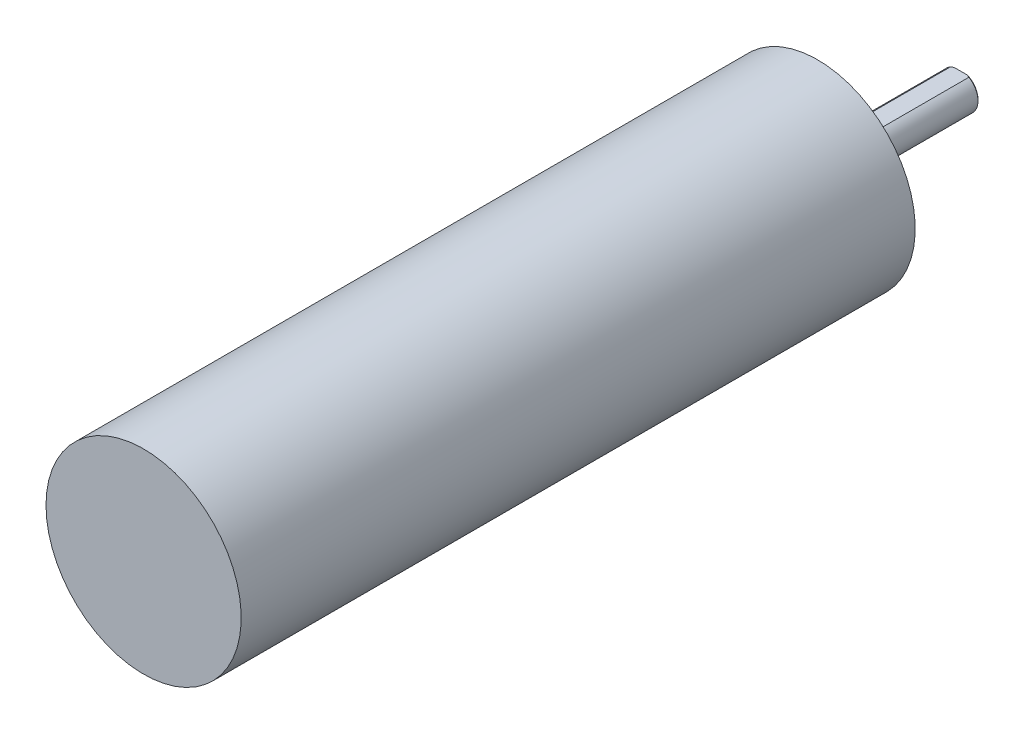
from build123d import *
from build123d.topology import SkipClean

# Parameters (mm, degrees)
SKETCH_1_R             = 8
EXTRUDE_1_DEPTH        = 55.2
EXTRUDE_2_DEPTH        = 11.8
SKETCH_3_R             = 3
EXTRUDE_3_DEPTH        = 1
SKETCH_4_R             = 2.75
EXTRUDE_4_DEPTH        = 1.6
EXTRUDE_5_DEPTH        = 0.05
EXTRUDE_5_DEPTH_BACK   = 2
SKETCH_5_R             = 8
HOLE_WIZARD_M2_1_D     = 1.6
HOLE_WIZARD_M2_1_DEPTH = 5.2
HOLE_WIZARD_M2_1_TIP   = 0.480688495
SKETCH1_R              = 1.5
EXTRUDE1_DEPTH         = 1.4
CHAMFER_2_SIZE         = 0.1


with BuildPart() as part:
    # 草图1 → 拉伸1 (new body)
    with BuildSketch(Plane.XY):
        with Locations(Location((0, 0, 0), (0, 0, 180))):
            Circle(SKETCH_1_R)
    extrude(amount=EXTRUDE_1_DEPTH)

    # 草图2 → 拉伸2 (add)
    with BuildSketch(Plane(origin=(0, 0, 0), x_dir=(-1, 0, 0), z_dir=(0, 0, -1))):
        with BuildLine():
            Line((-0.748331477, 1.3), (0.748331477, 1.3))
            ThreePointArc((0.748331477, 1.3), (0, -1.5), (-0.748331477, 1.3))
        make_face()
    extrude(amount=EXTRUDE_2_DEPTH)

    # 草图3 → 拉伸3 (add)
    with BuildSketch(Plane(origin=(0, 0, 0), x_dir=(-1, 0, 0), z_dir=(0, 0, -1))):
        with Locations(Location((0, 0, 0), (0, 0, 180))):
            Circle(SKETCH_3_R)
    extrude(amount=EXTRUDE_3_DEPTH)

    # 草图4 → 拉伸4 (add)
    with BuildSketch(Plane(origin=(0, 0, -1), x_dir=(-1, 0, 0), z_dir=(0, 0, -1))):
        Circle(SKETCH_4_R)
    extrude(amount=EXTRUDE_4_DEPTH)

    # 草图5 → 拉伸5 (add, two sides: drawn at the far end of the back side and taken through both)
    with BuildSketch(Plane(origin=(0, 0, 0), x_dir=(-1, 0, 0), z_dir=(0, 0, -1)).offset(-EXTRUDE_5_DEPTH_BACK)):
        Circle(SKETCH_5_R)
    extrude(amount=EXTRUDE_5_DEPTH + EXTRUDE_5_DEPTH_BACK)

    # M2 螺纹孔1
    with Locations(Plane(origin=(5.5, 0, -0.05), x_dir=(-1, 0, 0), z_dir=(0, 0, -1))):
        with Locations((0, 0), (11, 0)):
            Hole(HOLE_WIZARD_M2_1_D / 2, depth=HOLE_WIZARD_M2_1_DEPTH)
            with Locations((0, 0, -(HOLE_WIZARD_M2_1_DEPTH + HOLE_WIZARD_M2_1_TIP / 2))):  # 118° drill point
                Cone(0, HOLE_WIZARD_M2_1_D / 2, HOLE_WIZARD_M2_1_TIP, mode=Mode.SUBTRACT)

    # Sketch1 → Extrude1 (add)
    with SkipClean():  # the faces are left unmerged after this step: merging them gives an invalid solid
        with BuildSketch(Plane(origin=(0, 0, -2.6), x_dir=(-1, 0, 0), z_dir=(0, 0, -1))):
            with Locations(Location((0, 0, 0), (0, 0, 119.926434867))):
                Circle(SKETCH1_R)
        extrude(amount=EXTRUDE1_DEPTH)

    # 倒角2
    chamfer_2_edges = [part.edges().sort_by_distance(p)[0] for p in [
        (0, -1.5, -11.8),
    ]]
    chamfer(chamfer_2_edges, length=CHAMFER_2_SIZE)


solid = part.part
